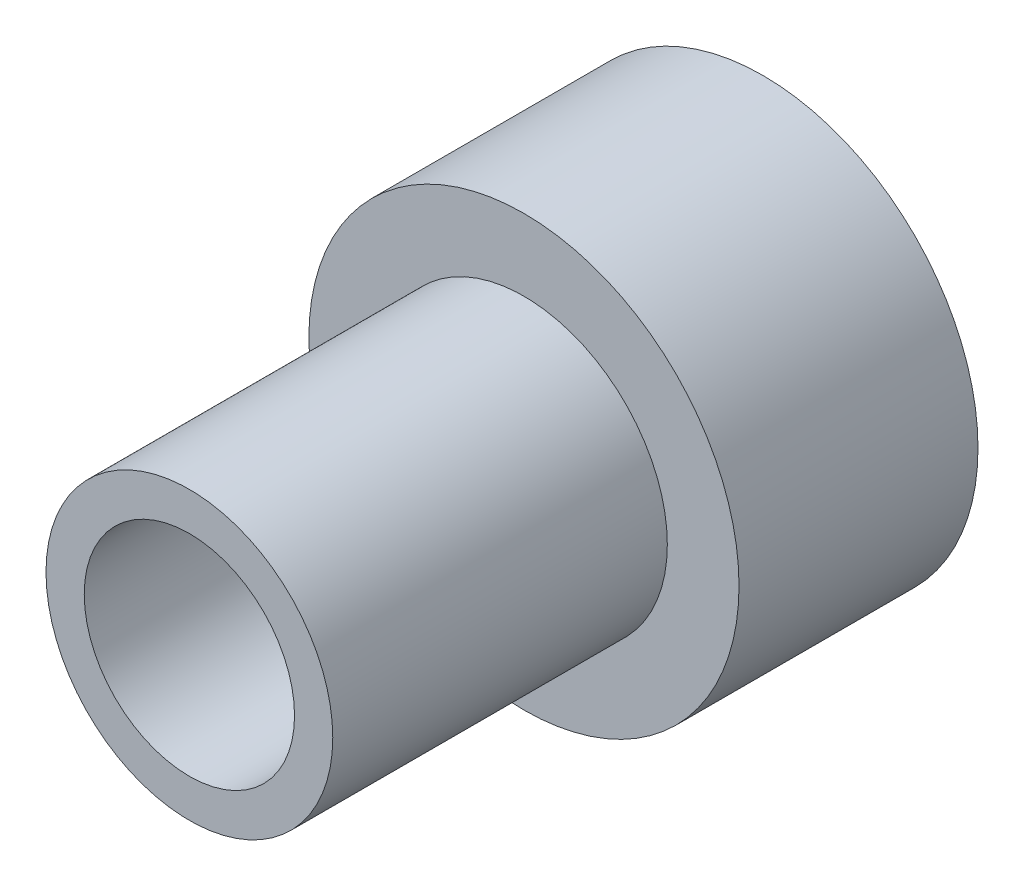
from build123d import *


with BuildPart() as part:
    # Sketch1 → Revolve1 (revolve)
    with BuildSketch(Plane(origin=(0, 0, 0), x_dir=(1, 0, 0), z_dir=(0, 1, 0)), mode=Mode.PRIVATE) as revolve1_sk:
        Polygon((-1.1, 0), (-1.5, 0), (-1.5, 3.5), (-2.25, 3.5), (-2.25, 6), (-1.9, 6), (-1.9, 4.5), (-1.1, 4.5), align=None)
    revolve(revolve1_sk.sketch.rotate(Axis((0, 0, 0), (0, 0, -1)), 180), axis=Axis((0, 0, 0), (0, 0, -1)))


solid = part.part
